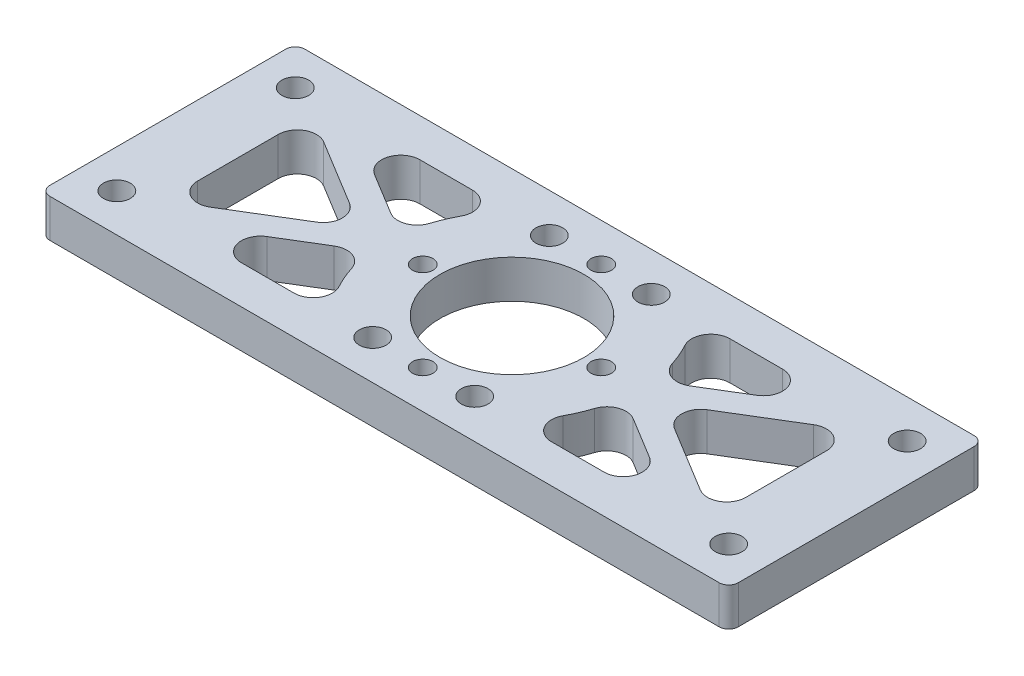
from build123d import *

# Parameters (mm, degrees)
SKETCH_1_W          = 108
SKETCH_1_H          = 40
SKETCH_1_R          = 11.3
SKETCH_1_R_2        = 1.6
SKETCH_1_R_3        = 2.1
EXTRUDE_1_DEPTH     = 3
FILLET_1_R          = 1.5
CUT_EXTRUDE_1_DEPTH = 58.896459305
FILLET_2_R          = 3


with BuildPart() as part:
    # 草图1 → 凸台-拉伸1 (new, symmetric)
    with BuildSketch(Plane(origin=(0, 0, 0), x_dir=(1, 0, 0), z_dir=(0, 1, 0))):
        Rectangle(SKETCH_1_W, SKETCH_1_H)
        with Locations(Location((0, 0, 0), (0, 0, 270))):
            Circle(SKETCH_1_R, mode=Mode.SUBTRACT)
        with Locations(Location((0, 14, 0), (0, 0, 270))):
            Circle(SKETCH_1_R_2, mode=Mode.SUBTRACT)
        with Locations(Location((8, 13.856406461, 0), (0, 0, 270))):
            Circle(SKETCH_1_R_3, mode=Mode.SUBTRACT)
        with Locations(Location((8, -13.856406461, 0), (0, 0, 270))):
            Circle(SKETCH_1_R_3, mode=Mode.SUBTRACT)
        with Locations(Location((-8, -13.856406461, 0), (0, 0, 270))):
            Circle(SKETCH_1_R_3, mode=Mode.SUBTRACT)
        with Locations(Location((-8, 13.856406461, 0), (0, 0, 270))):
            Circle(SKETCH_1_R_3, mode=Mode.SUBTRACT)
        with Locations(Location((14, 0, 0), (0, 0, 270))):
            Circle(SKETCH_1_R_2, mode=Mode.SUBTRACT)
        with Locations(Location((0, -14, 0), (0, 0, 270))):
            Circle(SKETCH_1_R_2, mode=Mode.SUBTRACT)
        with Locations(Location((-14, 0, 0), (0, 0, 270))):
            Circle(SKETCH_1_R_2, mode=Mode.SUBTRACT)
        with Locations(Location((-48, -14, 0), (0, 0, 270))):
            Circle(SKETCH_1_R_3, mode=Mode.SUBTRACT)
        with Locations(Location((-48, 14, 0), (0, 0, 90))):
            Circle(SKETCH_1_R_3, mode=Mode.SUBTRACT)
        with Locations(Location((48, -14, 0), (0, 0, 90))):
            Circle(SKETCH_1_R_3, mode=Mode.SUBTRACT)
        with Locations(Location((48, 14, 0), (0, 0, 270))):
            Circle(SKETCH_1_R_3, mode=Mode.SUBTRACT)
    extrude(amount=EXTRUDE_1_DEPTH, both=True)

    # 圆角1
    fillet_1_edges = [part.edges().sort_by_distance(p)[0] for p in [
        (54, 0, 20),
        (-54, 0, 20),
        (-54, 0, -20),
        (54, 0, -20),
    ]]
    fillet(fillet_1_edges, radius=FILLET_1_R)

    # 草图3 → 切除-拉伸1 (cut, through all)
    with BuildSketch(Plane(origin=(0, 3, 0), x_dir=(1, 0, 0), z_dir=(0, 1, 0))):
        with BuildLine():
            Line((-39.153453709, 14), (-19.871537669, 2.263181541))
            ThreePointArc((-19.871537669, 2.263181541), (-18.057377806, 8.598319996), (-14.282856857, 14))
            Line((-14.282856857, 14), (-39.153453709, 14))
        make_face()
        Polygon((-43, 11.658623997), (-43, -11.658623997), (-23.846546291, 0), align=None)
        with BuildLine():
            Line((-39.153453709, -14), (-14.282856857, -14))
            ThreePointArc((-14.282856857, -14), (-18.057377806, -8.598319996), (-19.871537669, -2.263181541))
            Line((-19.871537669, -2.263181541), (-39.153453709, -14))
        make_face()
        with BuildLine():
            Line((14.282856857, -14), (39.153453709, -14))
            Line((39.153453709, -14), (19.871537669, -2.263181541))
            ThreePointArc((19.871537669, -2.263181541), (18.057377806, -8.598319996), (14.282856857, -14))
        make_face()
        Polygon((23.846546291, 0), (43, -11.658623997), (43, 11.658623997), align=None)
        with BuildLine():
            ThreePointArc((14.282856857, 14), (18.057377806, 8.598319996), (19.871537669, 2.263181541))
            Line((19.871537669, 2.263181541), (39.153453709, 14))
            Line((39.153453709, 14), (14.282856857, 14))
        make_face()
    extrude(amount=-CUT_EXTRUDE_1_DEPTH, mode=Mode.SUBTRACT)

    # 圆角2
    fillet_2_edges = [part.edges().sort_by_distance(p)[0] for p in [
        (-19.871537669, 0, 2.263181541),
        (-14.282856857, 0, 14),
        (-39.153453709, 0, 14),
        (-23.846546291, 0, 0),
        (-43, 0, 11.658623997),
        (-43, 0, -11.658623997),
        (23.846546291, 0, 0),
        (43, 0, -11.658623997),
        (43, 0, 11.658623997),
        (14.282856857, 0, 14),
        (19.871537669, 0, 2.263181541),
        (39.153453709, 0, 14),
        (19.871537669, 0, -2.263181541),
        (14.282856857, 0, -14),
        (39.153453709, 0, -14),
        (-14.282856857, 0, -14),
        (-19.871537669, 0, -2.263181541),
        (-39.153453709, 0, -14),
    ]]
    fillet(fillet_2_edges, radius=FILLET_2_R)


solid = part.part
